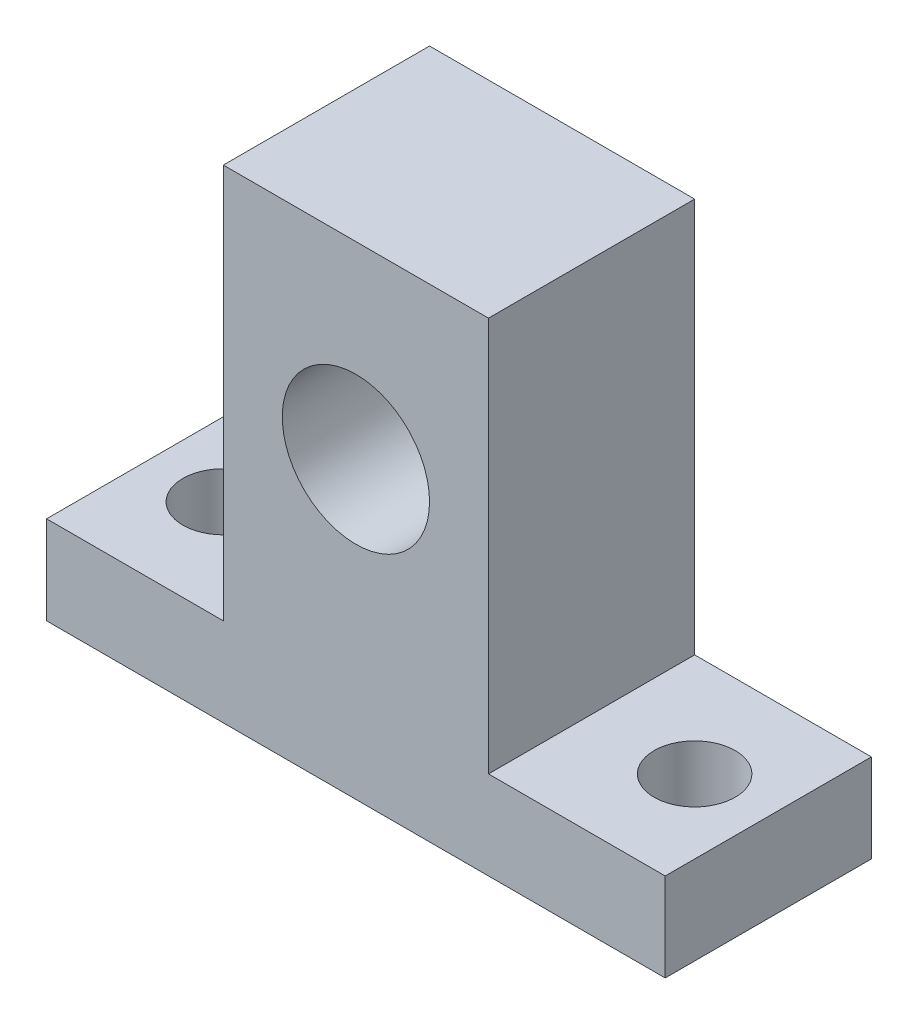
from build123d import *

# Parameters (mm, degrees)
SKETCH1_R           = 5
BOSS_EXTRUDE1_DEPTH = 7
SKETCH2_R           = 2.75
CUT_EXTRUDE1_DEPTH  = 35.759746835


with BuildPart() as part:
    # Sketch1 → Boss-Extrude1 (new, symmetric)
    with BuildSketch(Plane.XY):
        Polygon((-21, 0), (21, 0), (21, 6), (9, 6), (9, 32.8), (-9, 32.8), (-9, 6), (-21, 6), align=None)
        with Locations((0, 20)):
            Circle(SKETCH1_R, mode=Mode.SUBTRACT)
    extrude(amount=BOSS_EXTRUDE1_DEPTH, both=True)

    # Sketch2 → Cut-Extrude1 (cut, through all)
    with BuildSketch(Plane(origin=(0, 6, 0), x_dir=(1, 0, 0), z_dir=(0, 1, 0))):
        with Locations(Location((-16, 0, 0), (0, 0, 180))):
            Circle(SKETCH2_R)
        with Locations(Location((16, 0, 0), (0, 0, 180))):
            Circle(SKETCH2_R)
    extrude(amount=-CUT_EXTRUDE1_DEPTH, mode=Mode.SUBTRACT)


solid = part.part
